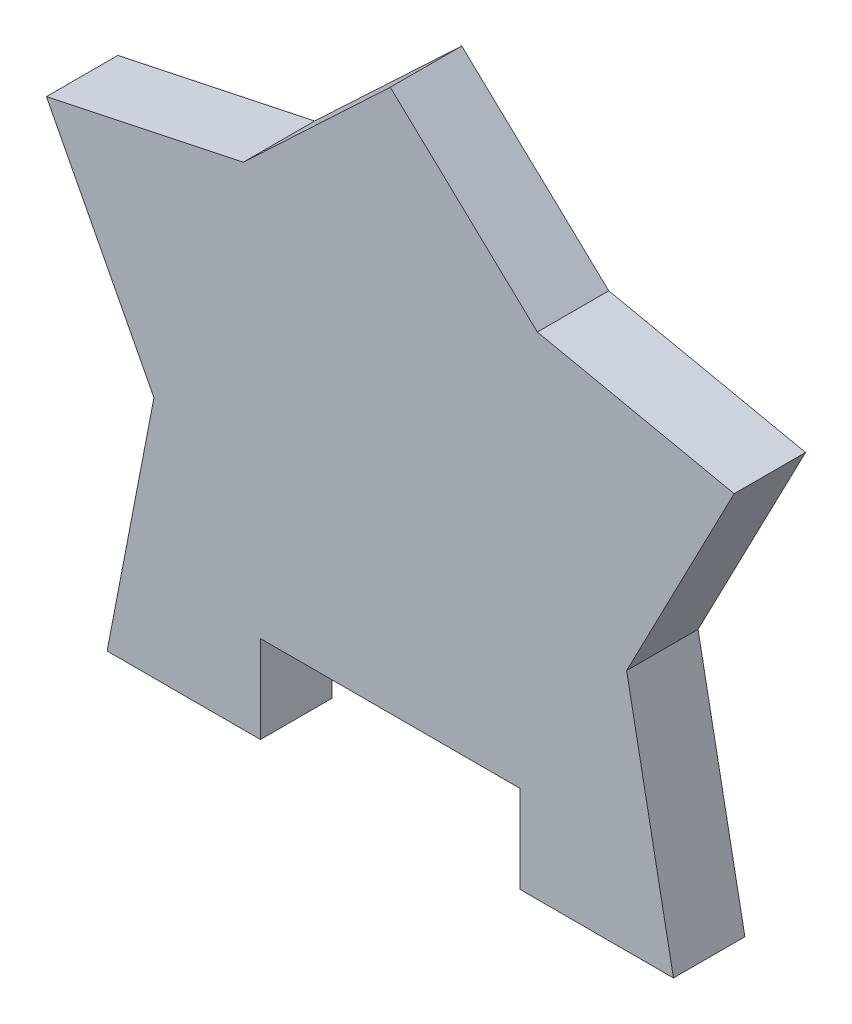
from build123d import *

# Parameters (mm, degrees)
RESSALTO_EXTRUS_O1_DEPTH = 10


with BuildPart() as part:
    # Esboço1 → Ressalto-extrusão1 (new body)
    with BuildSketch(Plane.XY):
        Polygon((0, 44.099252014), (-20.593389075, 24.708655469), (-48.152732896, 18.884258064), (-33.094534726, -10.09567049), (-39.654913616, -44.099252014), (-18.178395029, -44.099252014), (-18.178395029, -31.847977088), (18.178395029, -31.847977088), (18.178395029, -44.099252014), (39.654913616, -44.099252014), (33.094534726, -10.09567049), (48.152732896, 18.884258064), (20.593389075, 24.708655469), align=None)
    extrude(amount=RESSALTO_EXTRUS_O1_DEPTH)


solid = part.part
